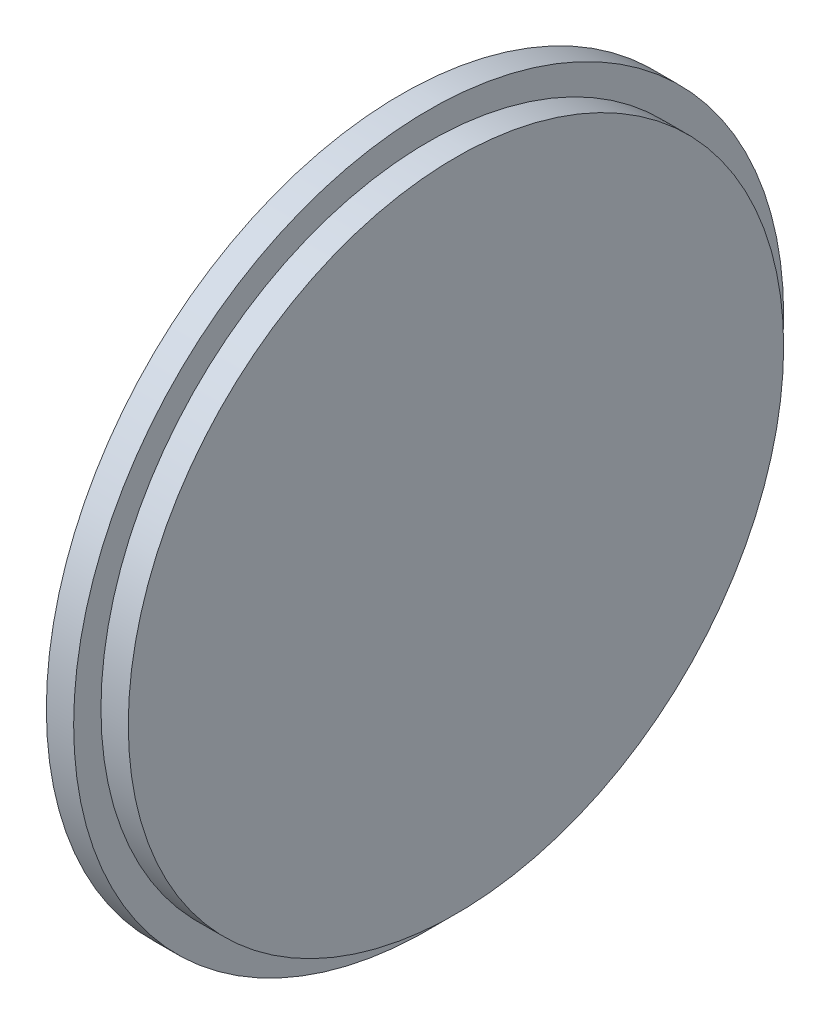
from build123d import *

# Parameters (mm, degrees)
SKETCH1_R           = 38.1
BOSS_EXTRUDE1_DEPTH = 3.175
SKETCH2_R           = 41.275
BOSS_EXTRUDE2_DEPTH = 3.175


with BuildPart() as part:
    # Sketch1 → Boss-Extrude1 (new body)
    with BuildSketch(Plane(origin=(0, 0, 0), x_dir=(0, 0, -1), z_dir=(1, 0, 0))):
        Circle(SKETCH1_R)
    extrude(amount=BOSS_EXTRUDE1_DEPTH)

    # Sketch2 → Boss-Extrude2 (add)
    with BuildSketch(Plane.ZY):
        Circle(SKETCH2_R)
    extrude(amount=BOSS_EXTRUDE2_DEPTH)


solid = part.part
